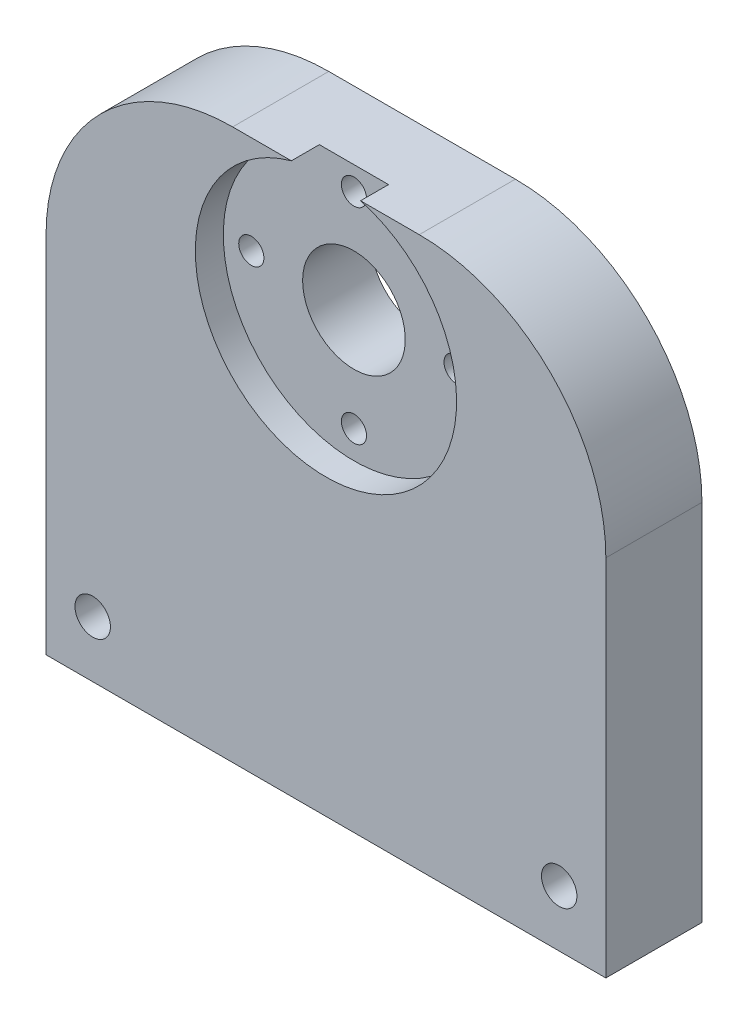
from build123d import *

# Parameters (mm, degrees)
IZIM1_R                     = 1.9
IZIM1_R_2                   = 5.5
IZIM1_R_3                   = 1.35
Y_KSEKLIK_EKSTR_ZYON1_DEPTH = 10.3
IZIM2_R                     = 14
KES_EKSTR_ZYON1_DEPTH       = 3


with BuildPart() as part:
    # Çizim1 → Yükseklik-Ekstrüzyon1 (new body)
    with BuildSketch(Plane.XY):
        with BuildLine():
            Line((-15.927254298, -20.437118131), (44.072745702, -20.437118131))
            Line((44.072745702, -20.437118131), (44.072745702, 18.562881869))
            ThreePointArc((44.072745702, 18.562881869), (38.214881326, 32.705017493), (24.072745702, 38.562881869))
            Line((24.072745702, 38.562881869), (4.072745702, 38.562881869))
            ThreePointArc((4.072745702, 38.562881869), (-10.069389922, 32.705017493), (-15.927254298, 18.562881869))
            Line((-15.927254298, 18.562881869), (-15.927254298, -20.437118131))
        make_face()
        with Locations(Location((-10.927254298, -14.397118131, 0), (0, 0, 180))):
            Circle(IZIM1_R, mode=Mode.SUBTRACT)
        with Locations(Location((39.072745702, -14.397118131, 0), (0, 0, 180))):
            Circle(IZIM1_R, mode=Mode.SUBTRACT)
        with Locations(Location((14.072745702, 25.062881869, 0), (0, 0, 180))):
            Circle(IZIM1_R_2, mode=Mode.SUBTRACT)
        with Locations(Location((3.072745702, 25.062881869, 0), (0, 0, 180))):
            Circle(IZIM1_R_3, mode=Mode.SUBTRACT)
        with Locations(Location((14.072745702, 36.062881869, 0), (0, 0, 180))):
            Circle(IZIM1_R_3, mode=Mode.SUBTRACT)
        with Locations(Location((25.072745702, 25.062881869, 0), (0, 0, 180))):
            Circle(IZIM1_R_3, mode=Mode.SUBTRACT)
        with Locations(Location((14.072745702, 14.062881869, 0), (0, 0, 180))):
            Circle(IZIM1_R_3, mode=Mode.SUBTRACT)
    extrude(amount=Y_KSEKLIK_EKSTR_ZYON1_DEPTH)

    # Çizim2 → Kes-Ekstrüzyon1 (cut)
    with BuildSketch(Plane.XY.offset(10.3)):
        with Locations((14.072745702, 25.062881869)):
            Circle(IZIM2_R)
    extrude(amount=-KES_EKSTR_ZYON1_DEPTH, mode=Mode.SUBTRACT)


solid = part.part
